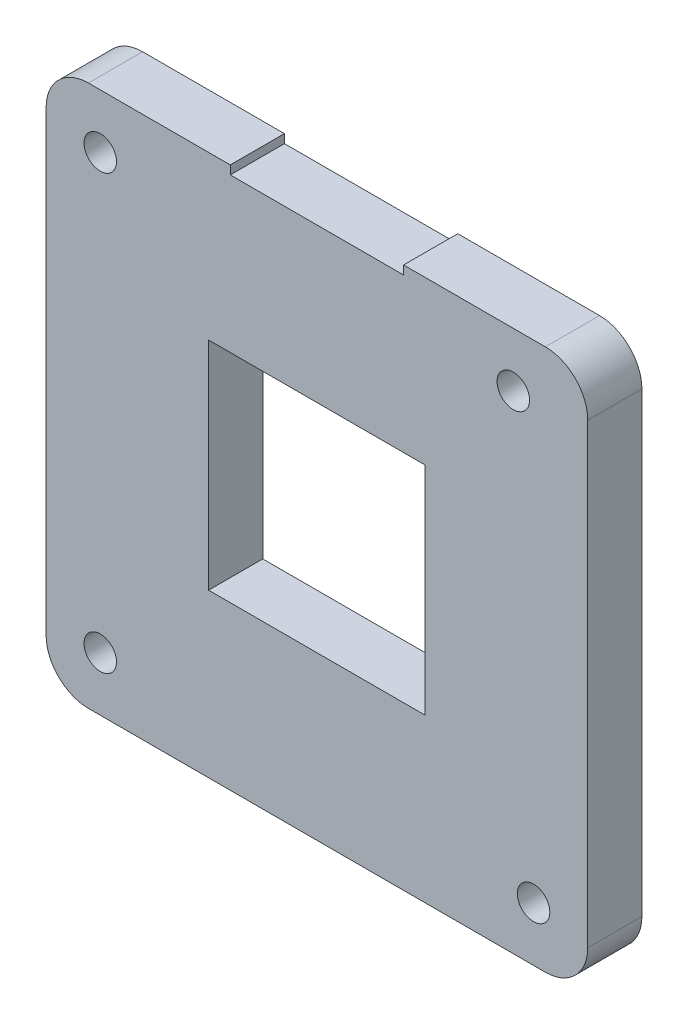
from build123d import *

# Parameters (mm, degrees)
BOSS_EXTRUDE1_DEPTH = 5
SKETCH2_W           = 20
SKETCH2_H           = 20
CUT_EXTRUDE1_DEPTH  = 5
SKETCH5_R           = 1.5
CUT_EXTRUDE2_DEPTH  = 36.707142143
SKETCH6_W           = 16
SKETCH6_H           = 0.8
CUT_EXTRUDE3_DEPTH  = 36.707142143


with BuildPart() as part:
    # Sketch1 → Boss-Extrude1 (new body)
    with BuildSketch(Plane.XY):
        with BuildLine():
            Line((-21.09, 25), (21.09, 25))
            ThreePointArc((21.09, 25), (23.854787514, 23.854787514), (25, 21.09))
            Line((25, 21.09), (25, -21.09))
            ThreePointArc((25, -21.09), (23.854787514, -23.854787514), (21.09, -25))
            Line((21.09, -25), (20.757353845, -25))
            Line((20.757353845, -25), (-21.09, -25))
            ThreePointArc((-21.09, -25), (-23.854787514, -23.854787514), (-25, -21.09))
            Line((-25, -21.09), (-25, 21.09))
            ThreePointArc((-25, 21.09), (-23.854787514, 23.854787514), (-21.09, 25))
        make_face()
    extrude(amount=BOSS_EXTRUDE1_DEPTH)

    # Sketch2 → Cut-Extrude1 (cut)
    with BuildSketch(Plane.XY.offset(5)):
        Rectangle(SKETCH2_W, SKETCH2_H)
    extrude(amount=-CUT_EXTRUDE1_DEPTH, mode=Mode.SUBTRACT)

    # Sketch5 → Cut-Extrude2 (cut, through all)
    with BuildSketch(Plane.XY.offset(5)):
        with Locations((-20, 20)):
            Circle(SKETCH5_R)
        with Locations((18.13054205, 20)):
            Circle(SKETCH5_R)
        with Locations((-20, -20)):
            Circle(SKETCH5_R)
        with Locations((20, -20)):
            Circle(SKETCH5_R)
    extrude(amount=-CUT_EXTRUDE2_DEPTH, mode=Mode.SUBTRACT)

    # Sketch6 → Cut-Extrude3 (cut, through all)
    with BuildSketch(Plane(origin=(0, 0, 0), x_dir=(-1, 0, 0), z_dir=(0, 0, -1))):
        with Locations((0, 24.6)):
            Rectangle(SKETCH6_W, SKETCH6_H)
    extrude(amount=-CUT_EXTRUDE3_DEPTH, mode=Mode.SUBTRACT)


solid = part.part
